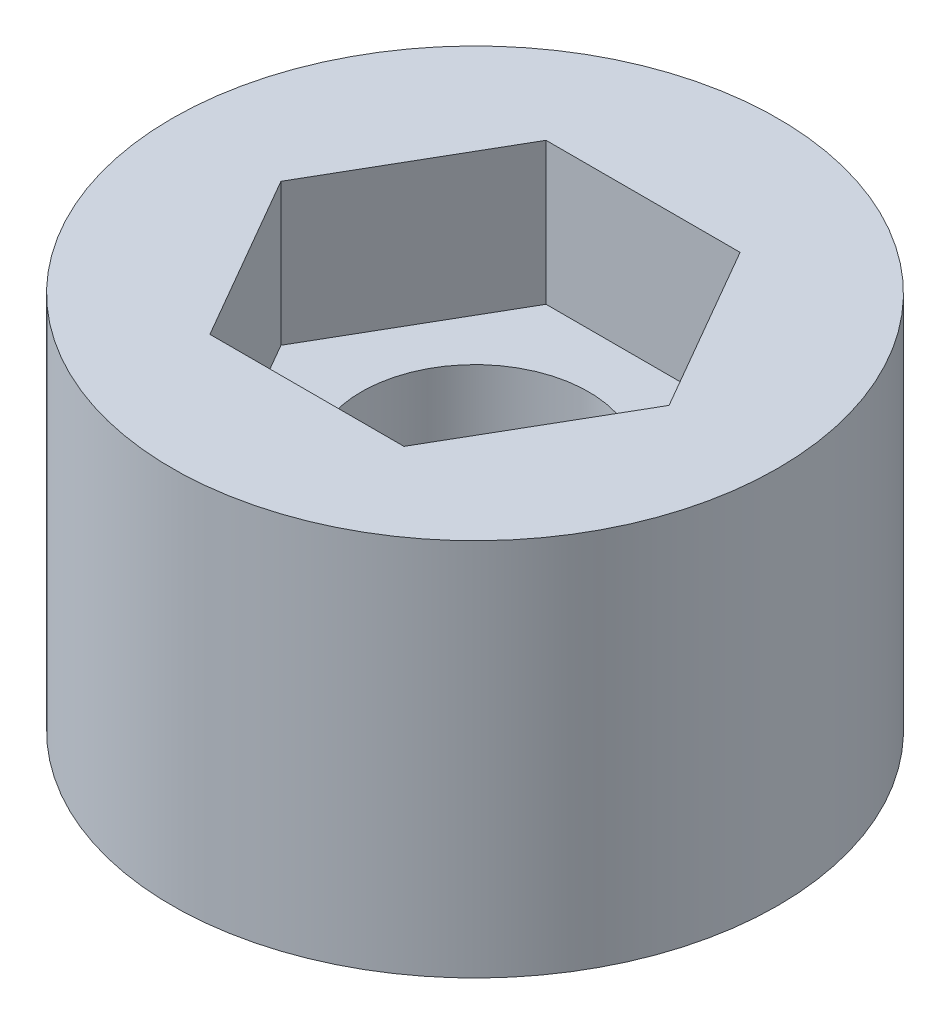
from build123d import *

# Parameters (mm, degrees)
SKETCH1_R           = 6.4
SKETCH1_R_2         = 2.4
EXTRUDE_THIN1_DEPTH = 8
CUT_EXTRUDE1_DEPTH  = 3


with BuildPart() as part:
    # Sketch1 → Extrude-Thin1 (new body)
    with BuildSketch(Plane(origin=(0, 0, 0), x_dir=(1, 0, 0), z_dir=(0, 1, 0))):
        Circle(SKETCH1_R)
        Circle(SKETCH1_R_2, mode=Mode.SUBTRACT)
    extrude(amount=EXTRUDE_THIN1_DEPTH)

    # Sketch2 → Cut-Extrude1 (cut)
    with BuildSketch(Plane(origin=(0, 8, 0), x_dir=(1, 0, 0), z_dir=(0, 1, 0))):
        Polygon((4.099186911, 0), (2.049593456, 3.55), (-2.049593456, 3.55), (-4.099186911, 0), (-2.049593456, -3.55), (2.049593456, -3.55), align=None)
    extrude(amount=-CUT_EXTRUDE1_DEPTH, mode=Mode.SUBTRACT)


solid = part.part
